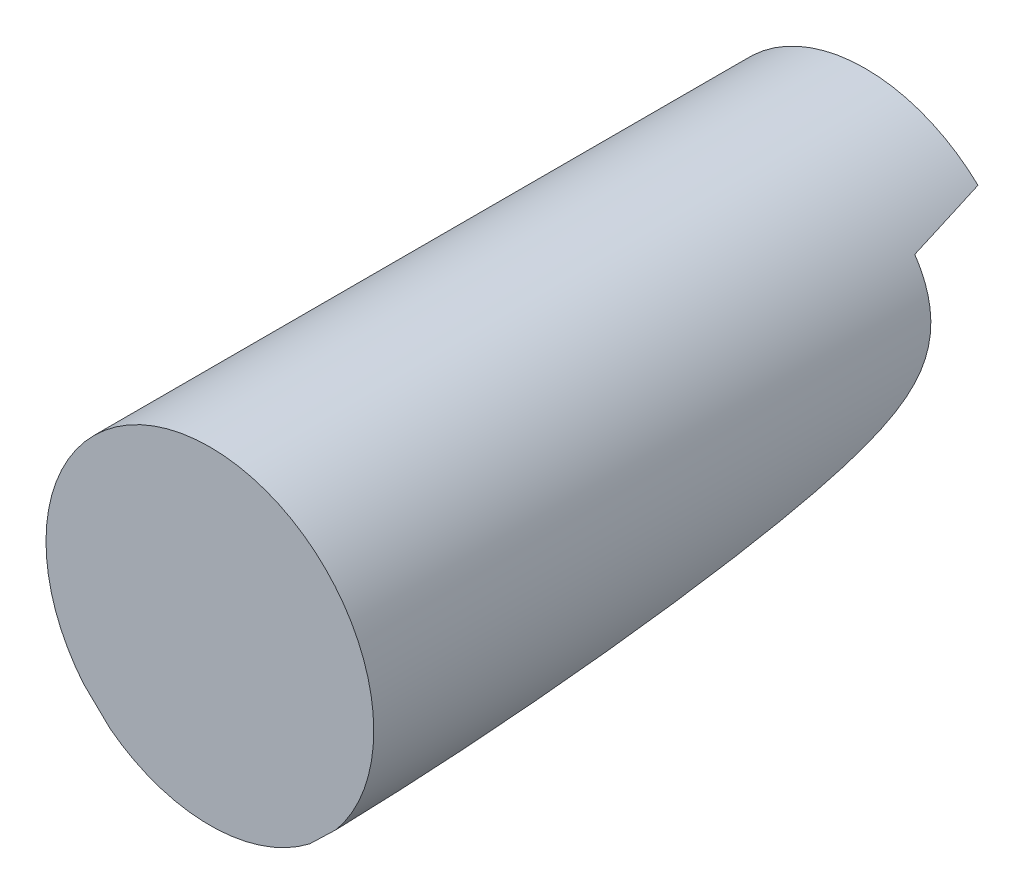
from build123d import *

# Parameters (mm, degrees)
SKETCH1_R           = 2.5
BOSS_EXTRUDE1_DEPTH = 10
CUT_EXTRUDE2_DEPTH  = 12


with BuildPart() as part:
    # Sketch1 → Boss-Extrude1 (new body)
    with BuildSketch(Plane.XY):
        Circle(SKETCH1_R)
    extrude(amount=BOSS_EXTRUDE1_DEPTH)

    # Sketch5 → Cut-Extrude2 (cut)
    with BuildSketch(Plane(origin=(0, -3.454207271, 10.011855364), x_dir=(1, 0, 0), z_dir=(0, -0.3396060060418324, 0.9405677863186231))):
        with BuildLine():
            Line((0, 0), (-1.926383071, 1.746152417))
            ThreePointArc((-1.926383071, 1.746152417), (0, -2.6), (1.926383071, 1.746152417))
            Line((1.926383071, 1.746152417), (0, 0))
        make_face()
    extrude(amount=-CUT_EXTRUDE2_DEPTH, mode=Mode.SUBTRACT)


solid = part.part
